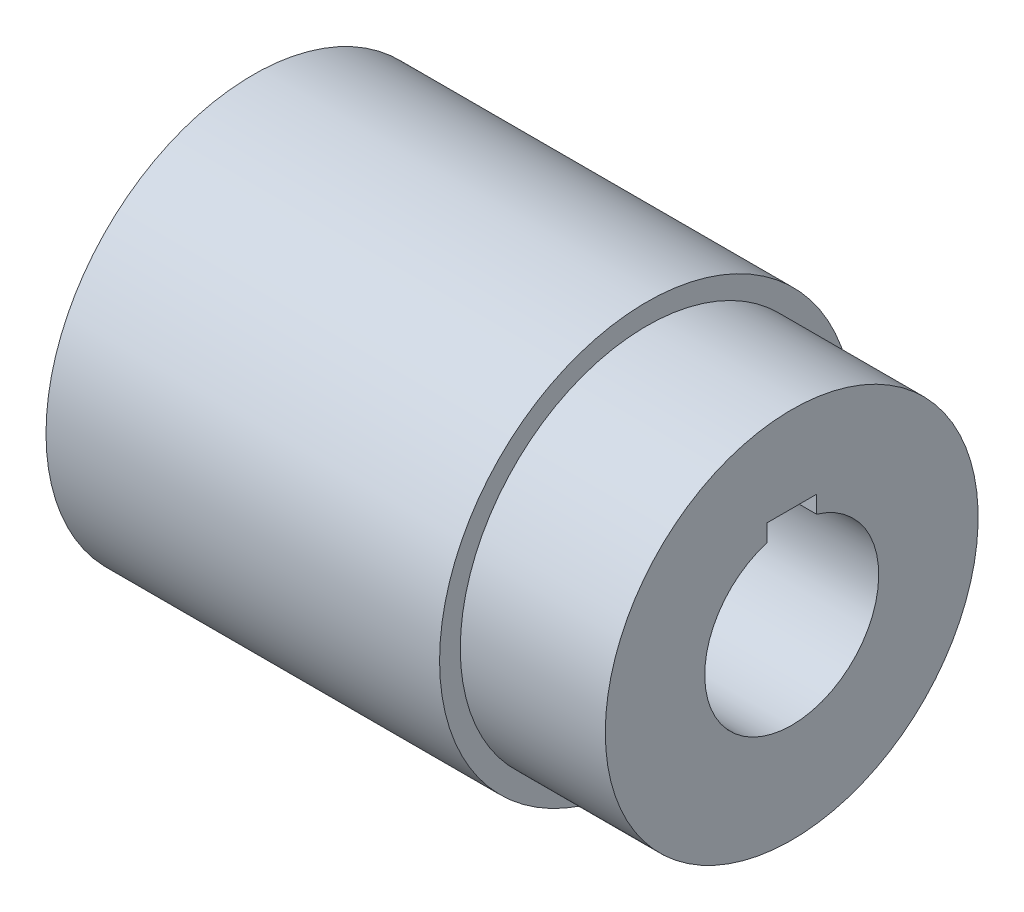
from build123d import *

# Parameters (mm, degrees)
SKETCH1_R                       = 50
SKETCH1_R_2                     = 21
BOSS_EXTRUDE1_DEPTH             = 130
CUT_EXTRUDE1_DEPTH              = 148.986485869
CUT_EXTRUDE1_DEPTH_BACK         = 148.986485869
SKETCH2_W                       = 12
SKETCH2_H                       = 6.6
SKETCH3_W                       = 35
SKETCH3_H                       = 5
SKETCH4_R                       = 32.5
CUT_EXTRUDE2_DEPTH              = 20
M8X1_0_TAPPED_HOLE1_D           = 7
M8X1_0_TAPPED_HOLE1_DEPTH       = 40
M8X1_0_TAPPED_HOLE1_CSINK_D     = 8.05
M8X1_0_TAPPED_HOLE1_CSINK_ANGLE = 90
M8X1_0_TAPPED_HOLE1_TIP         = 2.103012167


with BuildPart() as part:
    # Sketch1 → Boss-Extrude1 (new body)
    with BuildSketch(Plane(origin=(0, 0, 0), x_dir=(0, 0, -1), z_dir=(1, 0, 0))):
        Circle(SKETCH1_R)
        Circle(SKETCH1_R_2, mode=Mode.SUBTRACT)
    extrude(amount=BOSS_EXTRUDE1_DEPTH)

    # Sketch2 → Cut-Extrude1 (cut, two sides: drawn at the far end of the back side and taken through both)
    with BuildSketch(Plane.ZY.offset(-CUT_EXTRUDE1_DEPTH_BACK)):
        with Locations((0, 21)):
            Rectangle(SKETCH2_W, SKETCH2_H)
    extrude(amount=CUT_EXTRUDE1_DEPTH + CUT_EXTRUDE1_DEPTH_BACK, mode=Mode.SUBTRACT)

    # Sketch3 → Cut-Revolve1 (revolve, cut)
    with BuildSketch(Plane(origin=(0, 0, 0), x_dir=(1, 0, 0), z_dir=(0, 1, 0))):
        with Locations((112.5, -47.5)):
            Rectangle(SKETCH3_W, SKETCH3_H)
    revolve(axis=Axis((0, 0, 0), (1, 0, 0)), mode=Mode.SUBTRACT)

    # Sketch4 → Cut-Extrude2 (cut)
    with BuildSketch(Plane.ZY):
        Circle(SKETCH4_R)
    extrude(amount=-CUT_EXTRUDE2_DEPTH, mode=Mode.SUBTRACT)

    # M8x1.0 Tapped Hole1
    with Locations(Plane(origin=(0, 0, -42.5), x_dir=(0, 0, -1), z_dir=(-1, 0, 0))):
        with Locations((0, 0), (-85, 0)):
            CounterSinkHole(M8X1_0_TAPPED_HOLE1_D / 2, M8X1_0_TAPPED_HOLE1_CSINK_D / 2, depth=M8X1_0_TAPPED_HOLE1_DEPTH, counter_sink_angle=M8X1_0_TAPPED_HOLE1_CSINK_ANGLE)
            with Locations((0, 0, -(M8X1_0_TAPPED_HOLE1_DEPTH + M8X1_0_TAPPED_HOLE1_TIP / 2))):  # 118° drill point
                Cone(0, M8X1_0_TAPPED_HOLE1_D / 2, M8X1_0_TAPPED_HOLE1_TIP, mode=Mode.SUBTRACT)


solid = part.part
